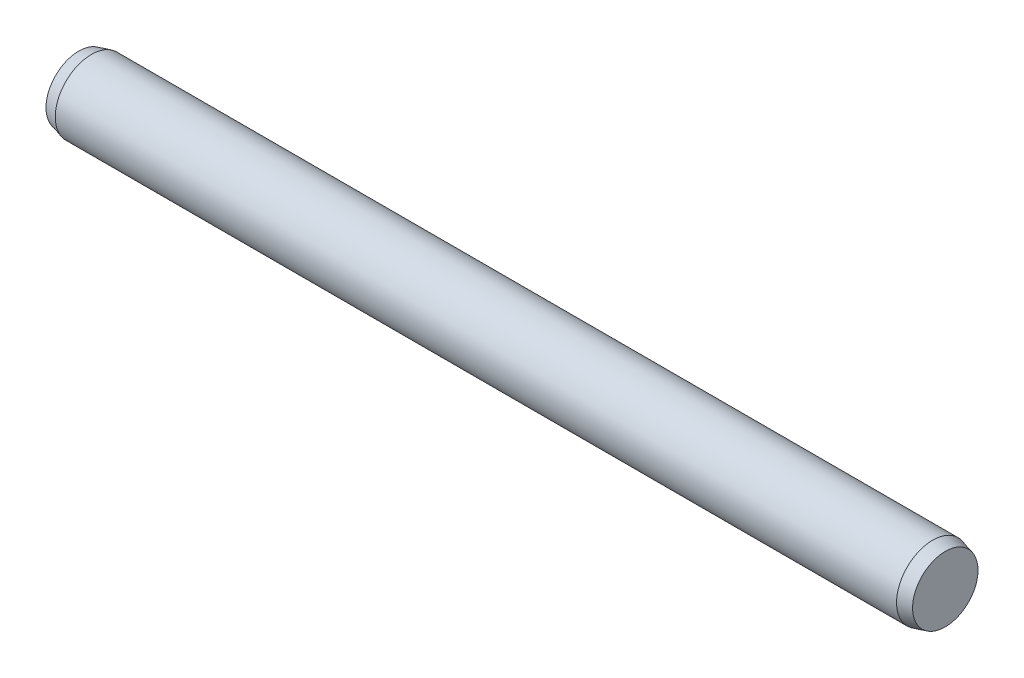
from build123d import *

# Parameters (mm, degrees)
EXTRUDE1_DEPTH      = 11.65
EXTRUDE1_DEPTH_BACK = 11.65
SKETCH2_R           = 1
SKETCH3_R           = 1
EXTRUDE2_DEPTH      = 0.35
EXTRUDE2_TAPER      = 15
SKETCH4_R           = 1
EXTRUDE3_DEPTH      = 0.35
EXTRUDE3_TAPER      = 15


with BuildPart() as part:
    # Sketch2 → Extrude1 (new, two sides: drawn at the far end of the back side and taken through both)
    with BuildSketch(Plane(origin=(0, 0, 0), x_dir=(0, 0, -1), z_dir=(1, 0, 0)).offset(-EXTRUDE1_DEPTH_BACK)):
        Circle(SKETCH2_R)
    extrude(amount=EXTRUDE1_DEPTH + EXTRUDE1_DEPTH_BACK)

    # Sketch3 → Extrude2 (add)
    with BuildSketch(Plane(origin=(11.65, 0, 0), x_dir=(0, 0, -1), z_dir=(1, 0, 0))):
        Circle(SKETCH3_R)
    extrude(amount=EXTRUDE2_DEPTH, taper=EXTRUDE2_TAPER)

    # Sketch4 → Extrude3 (add)
    with BuildSketch(Plane.ZY.offset(11.65)):
        with Locations(Location((0, 0, 0), (0, 0, 180))):
            Circle(SKETCH4_R)
    extrude(amount=EXTRUDE3_DEPTH, taper=EXTRUDE3_TAPER)


solid = part.part
